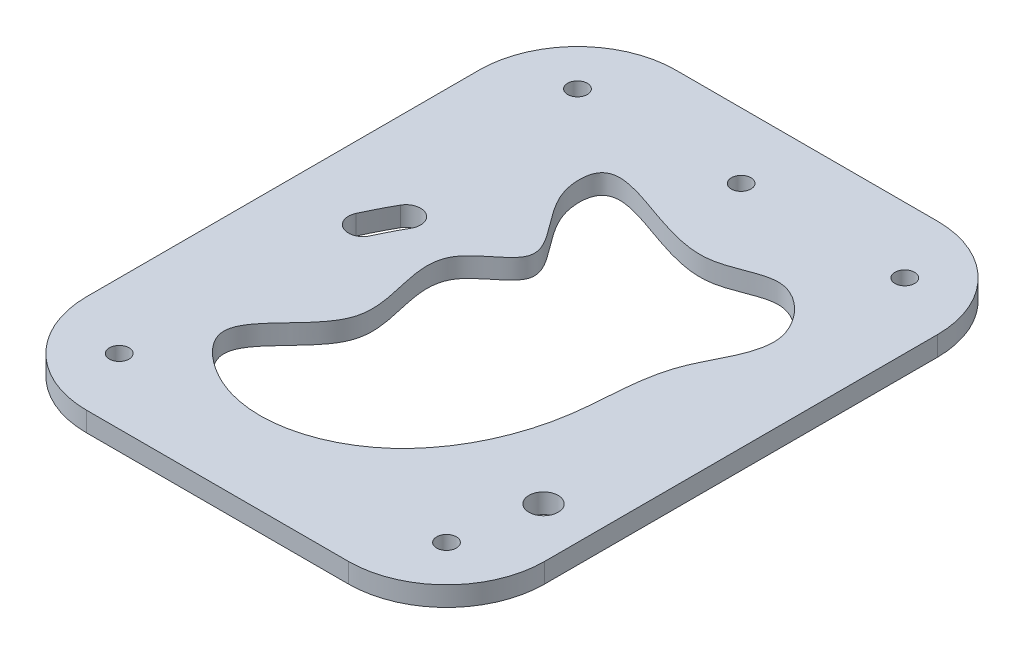
from build123d import *

# Parameters (mm, degrees)
SKETCH_1_R      = 1.5
SKETCH_1_R_2    = 2.237034671
EXTRUDE_1_DEPTH = 3


with BuildPart() as part:
    # 草图1 → 凸台-拉伸1 (new body)
    with BuildSketch(Plane(origin=(0, 0, 0), x_dir=(1, 0, 0), z_dir=(0, 1, 0))):
        with BuildLine():
            Line((-31.023812446, -43.872564636), (8.976187554, -43.872564636))
            ThreePointArc((8.976187554, -43.872564636), (19.582789272, -39.479166354), (23.976187554, -28.872564636))
            Line((23.976187554, -28.872564636), (23.976187554, 31.127435364))
            ThreePointArc((23.976187554, 31.127435364), (19.582789272, 41.734037082), (8.976187554, 46.127435364))
            Line((8.976187554, 46.127435364), (-31.023812446, 46.127435364))
            ThreePointArc((-31.023812446, 46.127435364), (-41.630414164, 41.734037082), (-46.023812446, 31.127435364))
            Line((-46.023812446, 31.127435364), (-46.023812446, -28.872564636))
            ThreePointArc((-46.023812446, -28.872564636), (-41.630414164, -39.479166354), (-31.023812446, -43.872564636))
        make_face()
        with Locations(Location((-11.023812446, 36.127435364, 0), (0, 0, 270))):
            Circle(SKETCH_1_R, mode=Mode.SUBTRACT)
        with Locations(Location((-36.023812446, 36.127435364, 0), (0, 0, 270))):
            Circle(SKETCH_1_R, mode=Mode.SUBTRACT)
        with Locations(Location((13.976187554, 36.127435364, 0), (0, 0, 270))):
            Circle(SKETCH_1_R, mode=Mode.SUBTRACT)
        with Locations(Location((13.976187554, -33.872564636, 0), (0, 0, 270))):
            Circle(SKETCH_1_R, mode=Mode.SUBTRACT)
        with Locations(Location((-36.023812446, -33.872564636, 0), (0, 0, 270))):
            Circle(SKETCH_1_R, mode=Mode.SUBTRACT)
        with Locations(Location((16.275363162, -21.356675147, 0), (0, 0, 270))):
            Circle(SKETCH_1_R_2, mode=Mode.SUBTRACT)
        with BuildLine():
            add(Edge.make_bspline(
                [(12.319654088, 18.984140414), (11.662970183, 22.095476654), (5.532541977, 28.70631143), (-6.047830609, 19.023530049), (-24.167678818, 32.702987186), (-23.880544953, 18.225663994), (-13.178760922, 10.930160516), (-28.337577672, 3.550262426), (-16.938047285, -11.926125951), (-35.179275795, -21.268605642), (-21.791294651, -33.62559034), (-1.66320244, -29.741236986), (7.787061798, -9.876691814), (6.545438729, 6.737164686), (13.147060286, 15.063930299), (12.319654088, 18.984140414)],
                knots=[0, 0, 0, 0, 0.05491714, 0.111470451, 0.226544888, 0.252267237, 0.32591222, 0.370316863, 0.460932615, 0.545777932, 0.589930563, 0.713238034, 0.843820619, 0.930805702, 1, 1, 1, 1], degree=3))
        make_face(mode=Mode.SUBTRACT)
        with BuildLine():
            ThreePointArc((-36.475278056, 2.723732677), (-35.369232429, -0.240269905), (-32.405229846, 0.865775722))
            ThreePointArc((-32.405229846, 0.865775722), (-31.389567016, 2.968042516), (-30.283171282, 5.024005828))
            ThreePointArc((-30.283171282, 5.024005828), (-31.126678225, 8.073127714), (-34.175800111, 7.229620771))
            ThreePointArc((-34.175800111, 7.229620771), (-35.374698497, 5.001764118), (-36.475278056, 2.723732677))
        make_face(mode=Mode.SUBTRACT)
    extrude(amount=EXTRUDE_1_DEPTH)


solid = part.part
